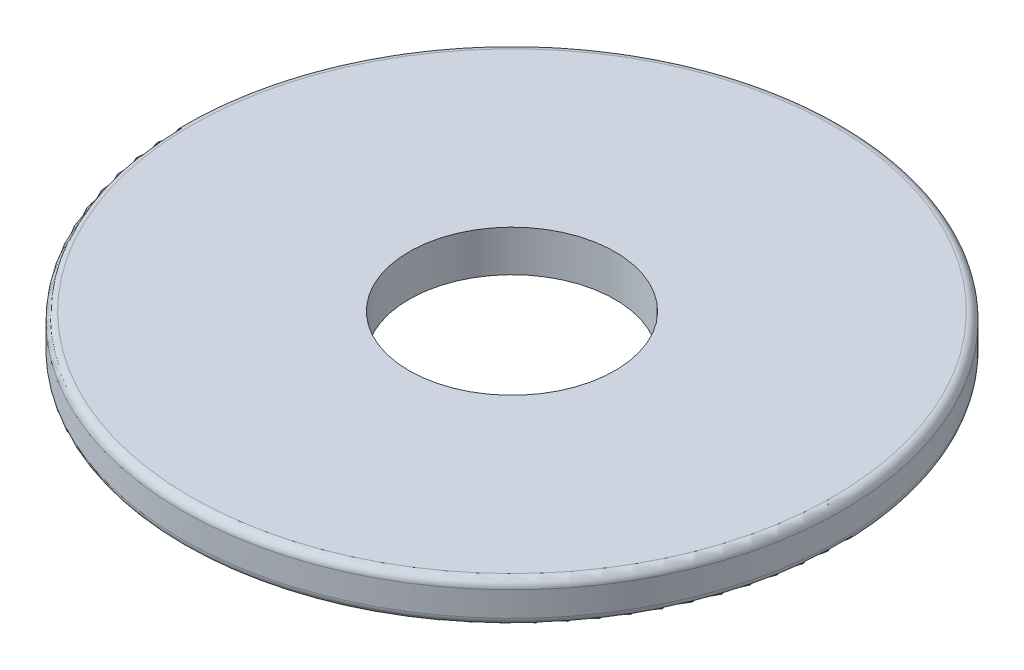
from build123d import *

# Parameters (mm, degrees)
SKETCH1_R           = 8
SKETCH1_R_2         = 2.5
BOSS_EXTRUDE1_DEPTH = 1
FILLET1_R           = 0.2


with BuildPart() as part:
    # Sketch1 → Boss-Extrude1 (new body)
    with BuildSketch(Plane(origin=(0, 0, 0), x_dir=(1, 0, 0), z_dir=(0, 1, 0))):
        with Locations(Location((0, 0, 0), (0, 0, 270))):
            Circle(SKETCH1_R)
        with Locations(Location((0, 0, 0), (0, 0, 270))):
            Circle(SKETCH1_R_2, mode=Mode.SUBTRACT)
    extrude(amount=BOSS_EXTRUDE1_DEPTH)

    # Fillet1
    fillet1_edges = [part.edges().sort_by_distance(p)[0] for p in [
        (0, 0, -8),
        (0, 1, -8),
    ]]
    fillet(fillet1_edges, radius=FILLET1_R)


solid = part.part
